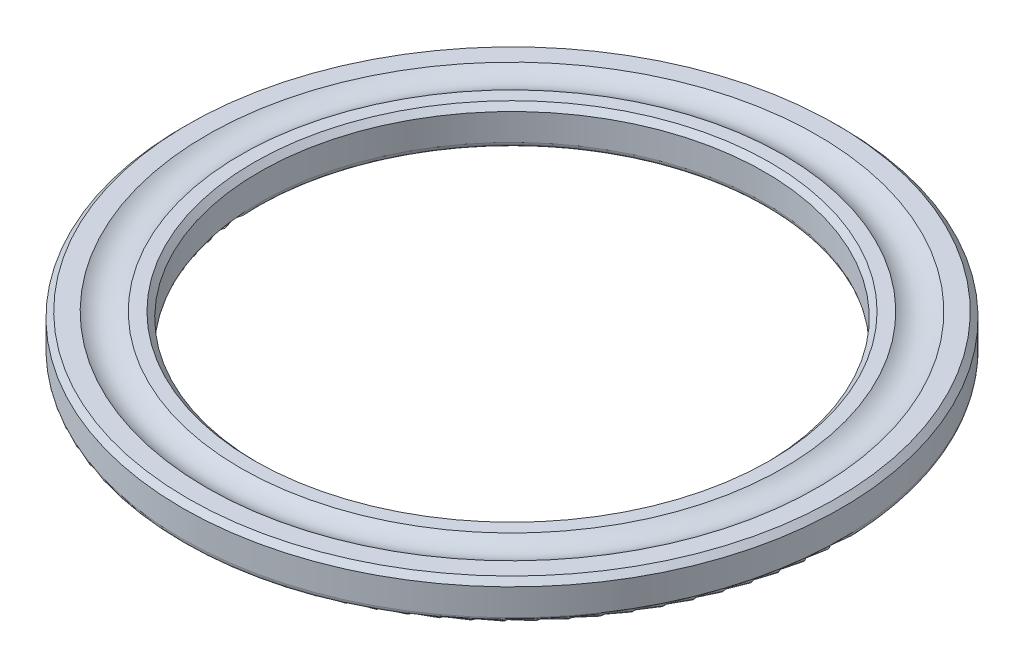
from build123d import *


with BuildPart() as part:
    # Sketch1 → Revolve1 (revolve)
    with BuildSketch(Plane(origin=(0, 0, 0), x_dir=(-1, 0, 0), z_dir=(0, 0, -1)), mode=Mode.PRIVATE) as revolve1_sk:
        with BuildLine():
            Line((-59, 0), (-47, 0))
            ThreePointArc((-47, 0), (-46.292893219, 0.292893219), (-46, 1))
            Line((-46, 1), (-46, 5.8724))
            Line((-46, 5.8724), (-47, 6.8724))
            Line((-47, 6.8724), (-49.4043, 6.8724))
            ThreePointArc((-49.4043, 6.8724), (-52.5, 5.8405), (-55.5957, 6.8724))
            Line((-55.5957, 6.8724), (-59, 6.8724))
            Line((-59, 6.8724), (-60, 5.8724))
            Line((-60, 5.8724), (-60, 1))
            ThreePointArc((-60, 1), (-59.707106781, 0.292893219), (-59, 0))
        make_face()
    revolve(revolve1_sk.sketch.rotate(Axis((0, 0, 0), (0, 1, 0)), 270), axis=Axis((0, 0, 0), (0, 1, 0)))


solid = part.part
